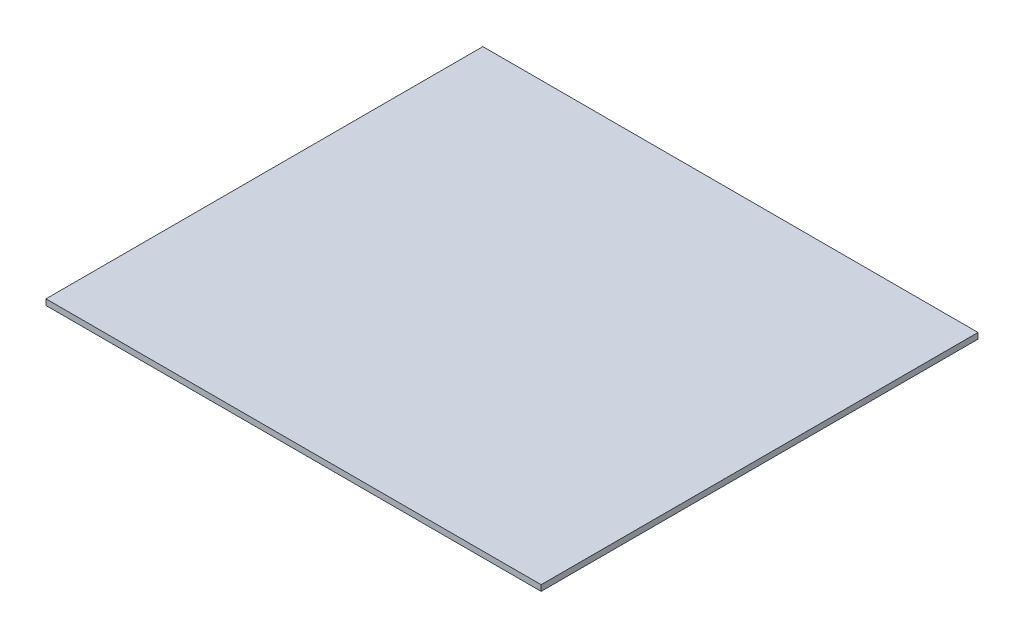
from build123d import *

# Parameters (mm, degrees)
EXTRUDE_1_DEPTH = 4


with BuildPart() as part:
    # Sketch 1 → Бобышка-Вытянуть1 (new body)
    with BuildSketch(Plane(origin=(-117.415970164, 10, 146.665591181), x_dir=(0.7498378553650926, 0, -0.6616216370868463), z_dir=(0, 1, 0))):
        Polygon((0, 0), (254.944870824, -224.95135661), (453.43136195, 0), (198.486491126, 224.95135661), align=None)
    extrude(amount=EXTRUDE_1_DEPTH)


solid = part.part
